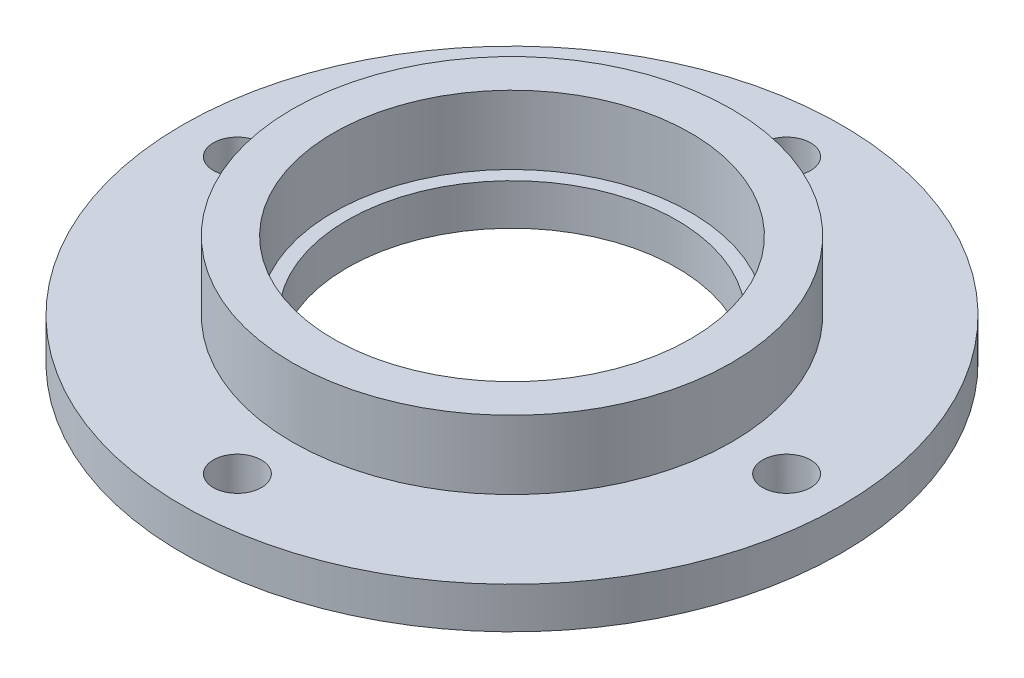
from build123d import *

# Parameters (mm, degrees)
CUT_EXTRUDE_1_DEPTH      = 35.307433597
CUT_EXTRUDE_1_DEPTH_BACK = 35.307433597
SKETCH_2_R               = 1.75


with BuildPart() as part:
    # 草图1 → 旋转1 (revolve)
    with BuildSketch(Plane.XY, mode=Mode.PRIVATE) as revolve_1_sk:
        Polygon((-12, 0), (-24, 0), (-24, 3), (-16, 3), (-16, 8), (-13, 8), (-13, 3), (-12, 3), align=None)
    revolve(revolve_1_sk.sketch.rotate(Axis((0, -271.309816207, 0), (0, 1, 0)), 180), axis=Axis((0, -271.309816207, 0), (0, 1, 0)))

    # 草图2 → 切除-拉伸1 (cut, two sides: drawn at the far end of the back side and taken through both)
    with BuildSketch(Plane(origin=(0, 3, 0), x_dir=(1, 0, 0), z_dir=(0, 1, 0)).offset(-CUT_EXTRUDE_1_DEPTH_BACK)):
        with Locations(Location((0, 20, 0), (0, 0, 180))):
            Circle(SKETCH_2_R)
        with Locations(Location((20, 0, 0), (0, 0, 180))):
            Circle(SKETCH_2_R)
        with Locations(Location((0, -20, 0), (0, 0, 180))):
            Circle(SKETCH_2_R)
        with Locations(Location((-20, 0, 0), (0, 0, 180))):
            Circle(SKETCH_2_R)
    extrude(amount=CUT_EXTRUDE_1_DEPTH + CUT_EXTRUDE_1_DEPTH_BACK, mode=Mode.SUBTRACT)


solid = part.part
